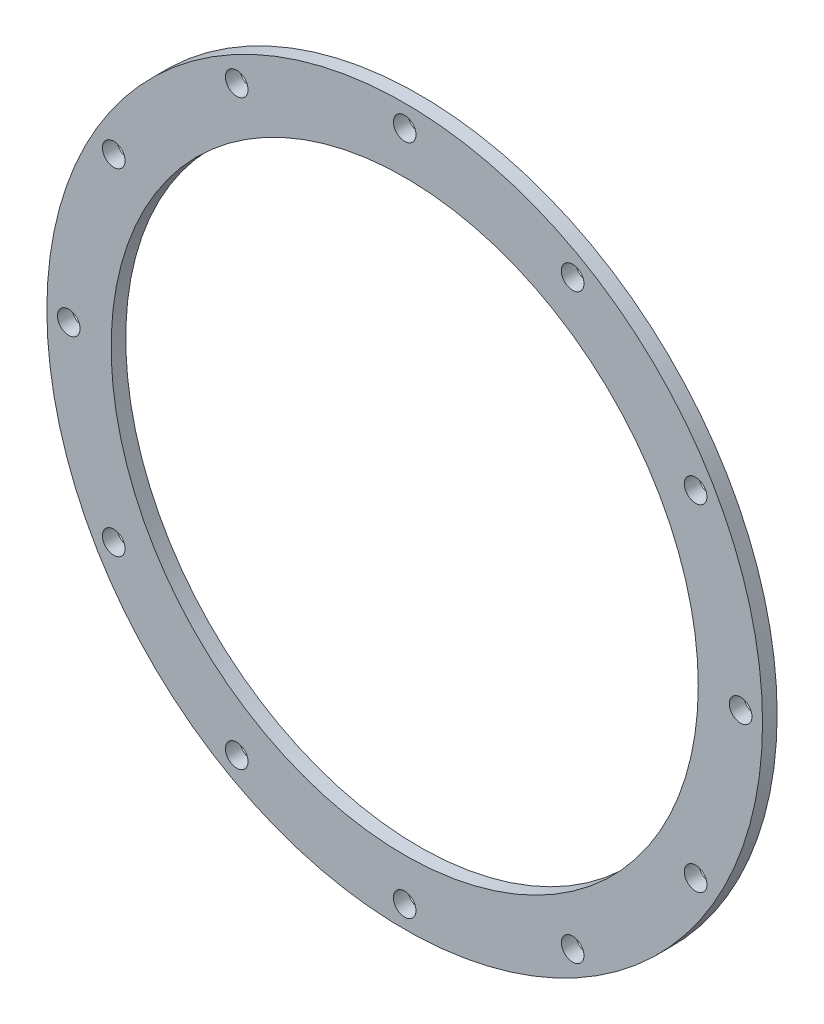
from build123d import *

# Parameters (mm, degrees)
SKETCH_1_R      = 49
SKETCH_1_R_2    = 40.2
SKETCH_1_R_3    = 1.55
EXTRUDE_1_DEPTH = 2


with BuildPart() as part:
    # 草图1 → 凸台-拉伸1 (new body)
    with BuildSketch(Plane.XY):
        Circle(SKETCH_1_R)
        Circle(SKETCH_1_R_2, mode=Mode.SUBTRACT)
        with Locations((0, 46)):
            Circle(SKETCH_1_R_3, mode=Mode.SUBTRACT)
        with Locations((23, 39.837168574)):
            Circle(SKETCH_1_R_3, mode=Mode.SUBTRACT)
        with Locations((39.837168574, 23)):
            Circle(SKETCH_1_R_3, mode=Mode.SUBTRACT)
        with Locations((46, 0)):
            Circle(SKETCH_1_R_3, mode=Mode.SUBTRACT)
        with Locations((39.837168574, -23)):
            Circle(SKETCH_1_R_3, mode=Mode.SUBTRACT)
        with Locations((23, -39.837168574)):
            Circle(SKETCH_1_R_3, mode=Mode.SUBTRACT)
        with Locations((0, -46)):
            Circle(SKETCH_1_R_3, mode=Mode.SUBTRACT)
        with Locations((-23, -39.837168574)):
            Circle(SKETCH_1_R_3, mode=Mode.SUBTRACT)
        with Locations((-39.837168574, -23)):
            Circle(SKETCH_1_R_3, mode=Mode.SUBTRACT)
        with Locations((-46, 0)):
            Circle(SKETCH_1_R_3, mode=Mode.SUBTRACT)
        with Locations((-39.837168574, 23)):
            Circle(SKETCH_1_R_3, mode=Mode.SUBTRACT)
        with Locations((-23, 39.837168574)):
            Circle(SKETCH_1_R_3, mode=Mode.SUBTRACT)
    extrude(amount=EXTRUDE_1_DEPTH)


solid = part.part
